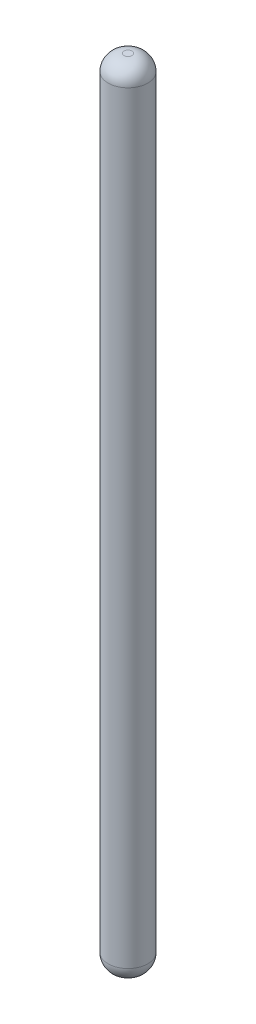
from build123d import *

# Parameters (mm, degrees)
SKETCH1_R           = 50
BOSS_EXTRUDE1_DEPTH = 1000
FILLET1_R           = 40


with BuildPart() as part:
    # Sketch1 → Boss-Extrude1 (new, symmetric)
    with BuildSketch(Plane(origin=(0, 0, 0), x_dir=(1, 0, 0), z_dir=(0, 1, 0))):
        with Locations(Location((0, 0, 0), (0, 0, 270))):
            Circle(SKETCH1_R)
    extrude(amount=BOSS_EXTRUDE1_DEPTH, both=True)

    # Fillet1
    fillet1_edges = [part.edges().sort_by_distance(p)[0] for p in [
        (0, -1000, -50),
        (0, 1000, -50),
    ]]
    fillet(fillet1_edges, radius=FILLET1_R)


solid = part.part
